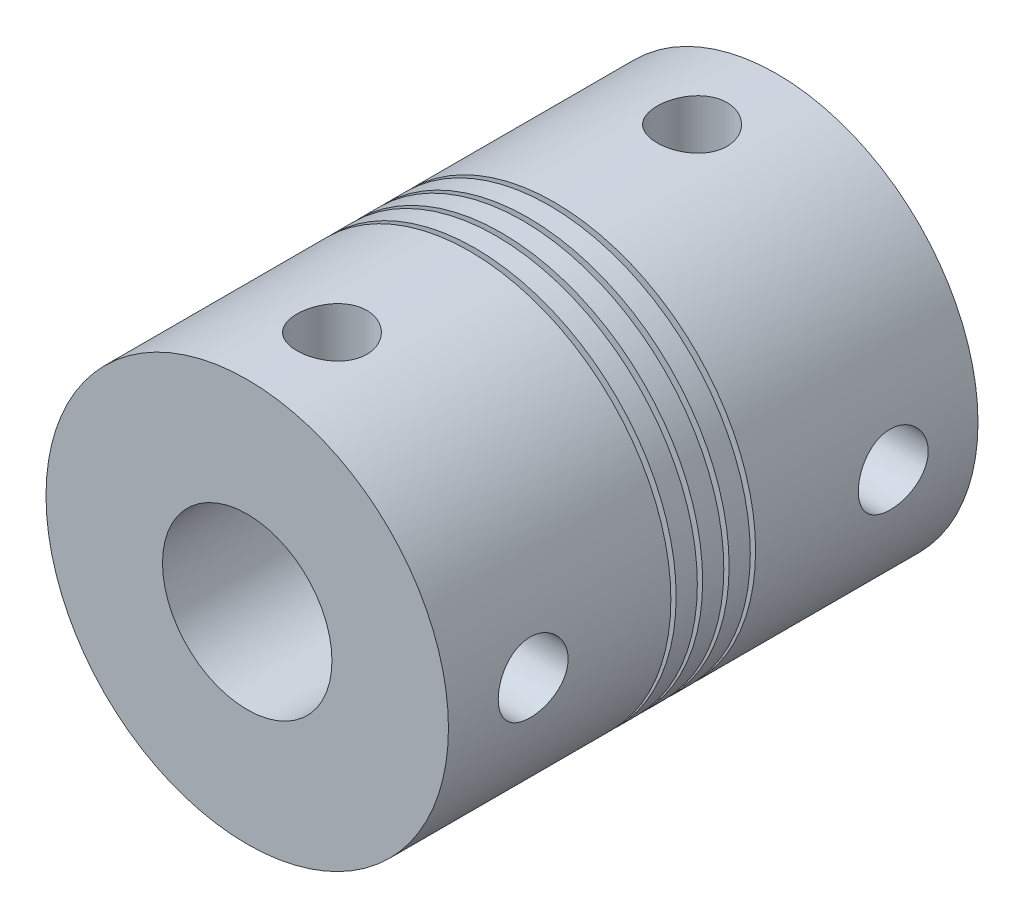
from build123d import *

# Parameters (mm, degrees)
M4X0_7_TAPPED_HOLE1_AT_2_COUNT = 2
M4X0_7_TAPPED_HOLE1_AT_2_PITCH = 17
M4X0_7_TAPPED_HOLE2_AT_2_COUNT = 2
M4X0_7_TAPPED_HOLE2_AT_2_PITCH = 17


with BuildPart() as part:
    # Sketch1 → Revolve3 (revolve)
    with BuildSketch(Plane(origin=(0, 0, 0), x_dir=(1, 0, 0), z_dir=(0, 1, 0))):
        Polygon((4, 0), (9.5, 0), (9.5, 10.5), (9, 10.5), (9, 10.75), (9.5, 10.75), (9.5, 11.75), (9, 11.75), (9, 12), (9.5, 12), (9.5, 13), (9, 13), (9, 13.25), (9.5, 13.25), (9.5, 14.25), (9, 14.25), (9, 14.5), (9.5, 14.5), (9.5, 25), (4, 25), align=None)
    revolve(axis=Axis((0, 0, 0), (0, 0, -1)))

    # Sketch3 → M4x0.7 Tapped Hole1 (revolve, cut)
    with BuildSketch(Plane(origin=(0, 0, -4), x_dir=(0, 0, -1), z_dir=(1, 0, 0))):
        Polygon((0, 0), (0, 11.091420021), (1.65, 10.1), (1.65, 0), align=None)
    m4x0_7_tapped_hole1 = revolve(axis=Axis((0, -6.35, -4), (0, 1, 0)), mode=Mode.SUBTRACT)

    # M4x0.7 Tapped Hole1 at 2: M4x0.7 Tapped Hole1 ×2
    with Locations(*[(0, 0, -i * M4X0_7_TAPPED_HOLE1_AT_2_PITCH) for i in range(1, M4X0_7_TAPPED_HOLE1_AT_2_COUNT)]):
        add(m4x0_7_tapped_hole1, mode=Mode.SUBTRACT)

    # Sketch7 → M4x0.7 Tapped Hole2 (revolve, cut)
    with BuildSketch(Plane(origin=(0, 0, -4), x_dir=(0, 0, 1), z_dir=(0, 1, 0))):
        Polygon((0, 0), (0, 11.091420021), (1.65, 10.1), (1.65, 0), align=None)
    m4x0_7_tapped_hole2 = revolve(axis=Axis((-6.35, 0, -4), (1, 0, 0)), mode=Mode.SUBTRACT)

    # M4x0.7 Tapped Hole2 at 2: M4x0.7 Tapped Hole2 ×2
    with Locations(*[(0, 0, -i * M4X0_7_TAPPED_HOLE2_AT_2_PITCH) for i in range(1, M4X0_7_TAPPED_HOLE2_AT_2_COUNT)]):
        add(m4x0_7_tapped_hole2, mode=Mode.SUBTRACT)


solid = part.part
